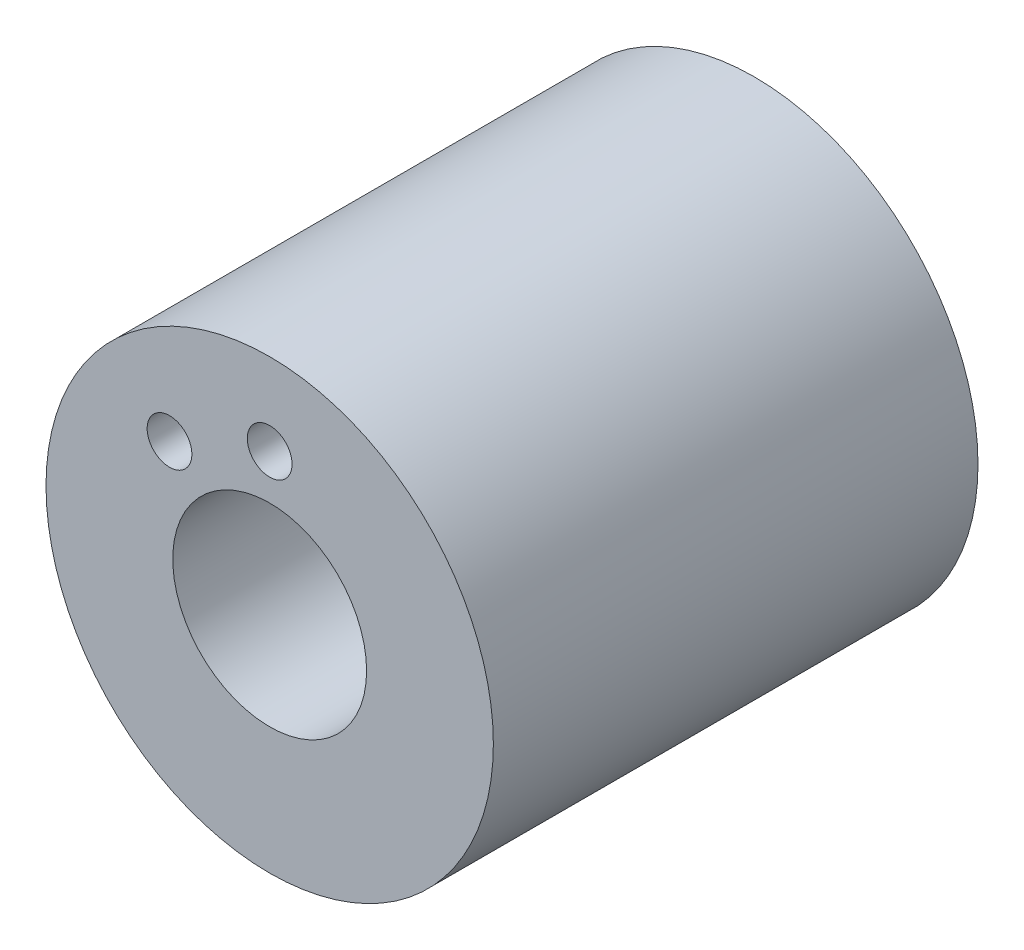
from build123d import *

# Parameters (mm, degrees)
SKETCH1_R           = 15
SKETCH1_R_2         = 6.5
SKETCH1_R_3         = 1.5
BOSS_EXTRUDE1_DEPTH = 16.25


with BuildPart() as part:
    # Sketch1 → Boss-Extrude1 (new, symmetric)
    with BuildSketch(Plane.XY):
        Circle(SKETCH1_R)
        Circle(SKETCH1_R_2, mode=Mode.SUBTRACT)
        with Locations((0, 9.5)):
            Circle(SKETCH1_R_3, mode=Mode.SUBTRACT)
        with Locations((-6.717514421, 6.717514421)):
            Circle(SKETCH1_R_3, mode=Mode.SUBTRACT)
    extrude(amount=BOSS_EXTRUDE1_DEPTH, both=True)


solid = part.part
